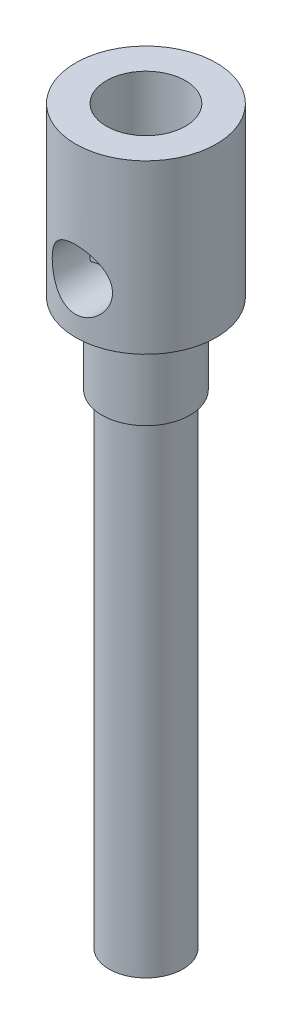
from build123d import *

# Parameters (mm, degrees)
SKETCH1_R               = 5.5
SKETCH1_R_2             = 2.58
BOSS_EXTRUDE1_DEPTH     = 72.14
SKETCH5_R               = 6.5785
BOSS_EXTRUDE2_DEPTH     = 12
SKETCH6_R               = 10.5
BOSS_EXTRUDE3_DEPTH     = 25
G1_4_TAPPED_HOLE2_D     = 11.8
G1_4_TAPPED_HOLE2_DEPTH = 20
G1_4_TAPPED_HOLE2_TIP   = 3.545077652
SKETCH15_R              = 2.5
BOSS_EXTRUDE4_DEPTH     = 18
M8_TAPPED_HOLE1_D       = 6.8
M8_TAPPED_HOLE1_DEPTH   = 79.14
M8_TAPPED_HOLE1_TIP     = 2.042926105
SKETCH18_R              = 4.5
CUT_EXTRUDE1_DEPTH      = 20


with BuildPart() as part:
    # Sketch1 → Boss-Extrude1 (new body)
    with BuildSketch(Plane(origin=(0, 0, 0), x_dir=(1, 0, 0), z_dir=(0, 1, 0))):
        with Locations(Location((0, 0, 0), (0, 0, 270))):
            Circle(SKETCH1_R)
        with Locations(Location((0, 0, 0), (0, 0, 270))):
            Circle(SKETCH1_R_2, mode=Mode.SUBTRACT)
    extrude(amount=BOSS_EXTRUDE1_DEPTH)

    # Sketch5 → Boss-Extrude2 (add)
    with BuildSketch(Plane(origin=(0, 72.14, 0), x_dir=(1, 0, 0), z_dir=(0, 1, 0))):
        with Locations(Location((0, 0, 0), (0, 0, 270))):
            Circle(SKETCH5_R)
    extrude(amount=BOSS_EXTRUDE2_DEPTH)

    # Sketch6 → Boss-Extrude3 (add)
    with BuildSketch(Plane(origin=(0, 84.14, 0), x_dir=(1, 0, 0), z_dir=(0, 1, 0))):
        with Locations(Location((0, 0, 0), (0, 0, 270))):
            Circle(SKETCH6_R)
    extrude(amount=BOSS_EXTRUDE3_DEPTH)

    # G1/4 Tapped Hole2
    with Locations(Plane(origin=(0, 109.14, 0), x_dir=(1, 0, 0), z_dir=(0, 1, 0))):
        with Locations((0, 0)):
            Hole(G1_4_TAPPED_HOLE2_D / 2, depth=G1_4_TAPPED_HOLE2_DEPTH)
            with Locations((0, 0, -(G1_4_TAPPED_HOLE2_DEPTH + G1_4_TAPPED_HOLE2_TIP / 2))):  # 118° drill point
                Cone(0, G1_4_TAPPED_HOLE2_D / 2, G1_4_TAPPED_HOLE2_TIP, mode=Mode.SUBTRACT)

    # Sketch15 → Boss-Extrude4 (add)
    with BuildSketch(Plane(origin=(0, 90.14, 0), x_dir=(-1, 0, 0), z_dir=(0, -1, 0))):
        with Locations(Location((0, 0, 0), (0, 0, 270))):
            Circle(SKETCH15_R)
    extrude(amount=BOSS_EXTRUDE4_DEPTH)

    # M8 Tapped Hole1
    with Locations(Plane(origin=(0, 90.14, 0), x_dir=(1, 0, 0), z_dir=(0, 1, 0))):
        with Locations((0, 0)):
            Hole(M8_TAPPED_HOLE1_D / 2, depth=M8_TAPPED_HOLE1_DEPTH)
            with Locations((0, 0, -(M8_TAPPED_HOLE1_DEPTH + M8_TAPPED_HOLE1_TIP / 2))):  # 118° drill point
                Cone(0, M8_TAPPED_HOLE1_D / 2, M8_TAPPED_HOLE1_TIP, mode=Mode.SUBTRACT)

    # Sketch18 → Cut-Extrude1 (cut)
    with BuildSketch(Plane.XY):
        with Locations(Location((0, 91.64, 0), (0, 0, 180))):
            Circle(SKETCH18_R)
    extrude(amount=CUT_EXTRUDE1_DEPTH, mode=Mode.SUBTRACT)


solid = part.part
